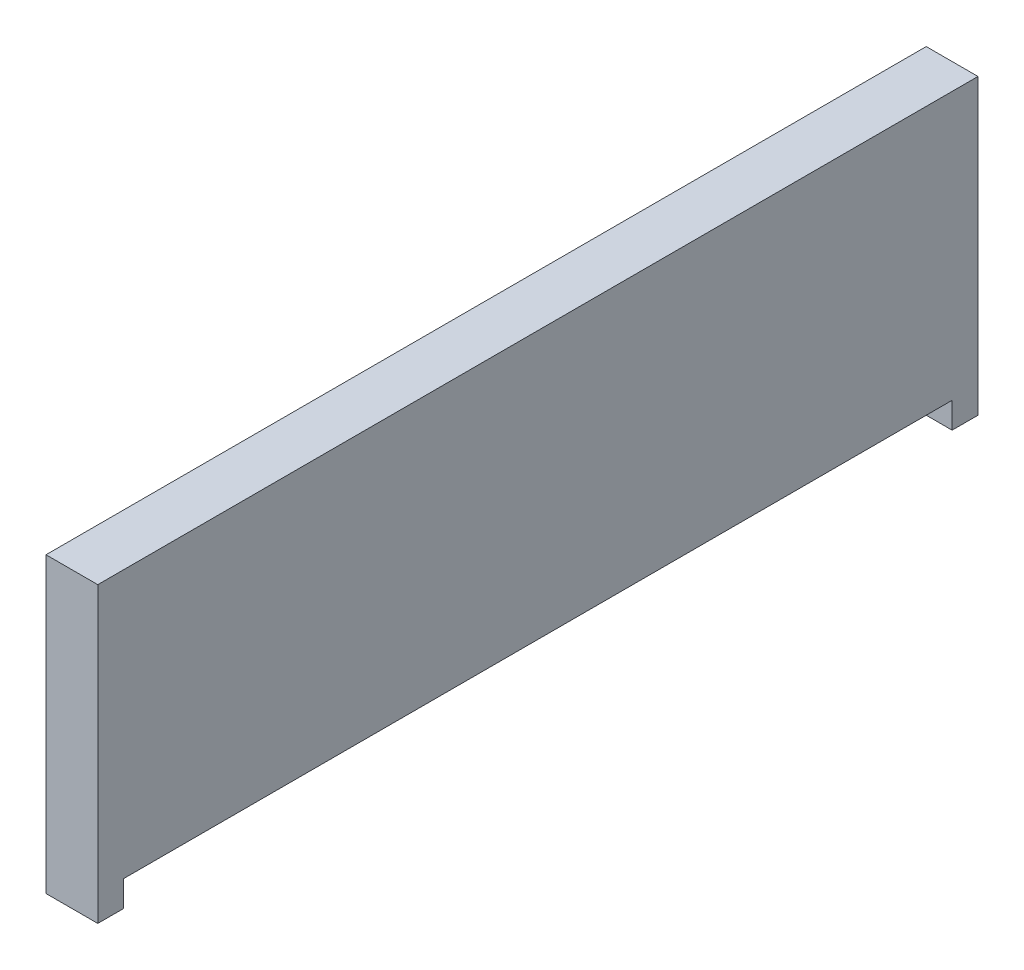
from build123d import *

# Parameters (mm, degrees)
EXTRUDE_1_DEPTH        = 510
SKETCH_2_W             = 15
SKETCH_2_H             = 15
EXTRUDE_2_DEPTH        = 15
PATTERN_LINEAR_1_COUNT = 2
PATTERN_LINEAR_1_PITCH = 495


with BuildPart() as part:
    # Эскиз1 → Бобышка-Вытянуть1 (new body)
    with BuildSketch(Plane.XY):
        Polygon((0, 0), (15, 0), (15, 15), (30, 15), (30, 170), (0, 170), align=None)
    extrude(amount=EXTRUDE_1_DEPTH)

    # Эскиз2 → Бобышка-Вытянуть2 (add)
    with BuildSketch(Plane(origin=(0, 0, 0), x_dir=(-1, 0, 0), z_dir=(0, 0, -1))):
        with Locations((-22.5, 7.5)):
            Rectangle(SKETCH_2_W, SKETCH_2_H)
    extrude_2 = extrude(amount=-EXTRUDE_2_DEPTH)

    # Линейный массив1: Бобышка-Вытянуть2 ×2
    with Locations(*[(0, 0, i * PATTERN_LINEAR_1_PITCH) for i in range(1, PATTERN_LINEAR_1_COUNT)]):
        add(extrude_2)


solid = part.part
